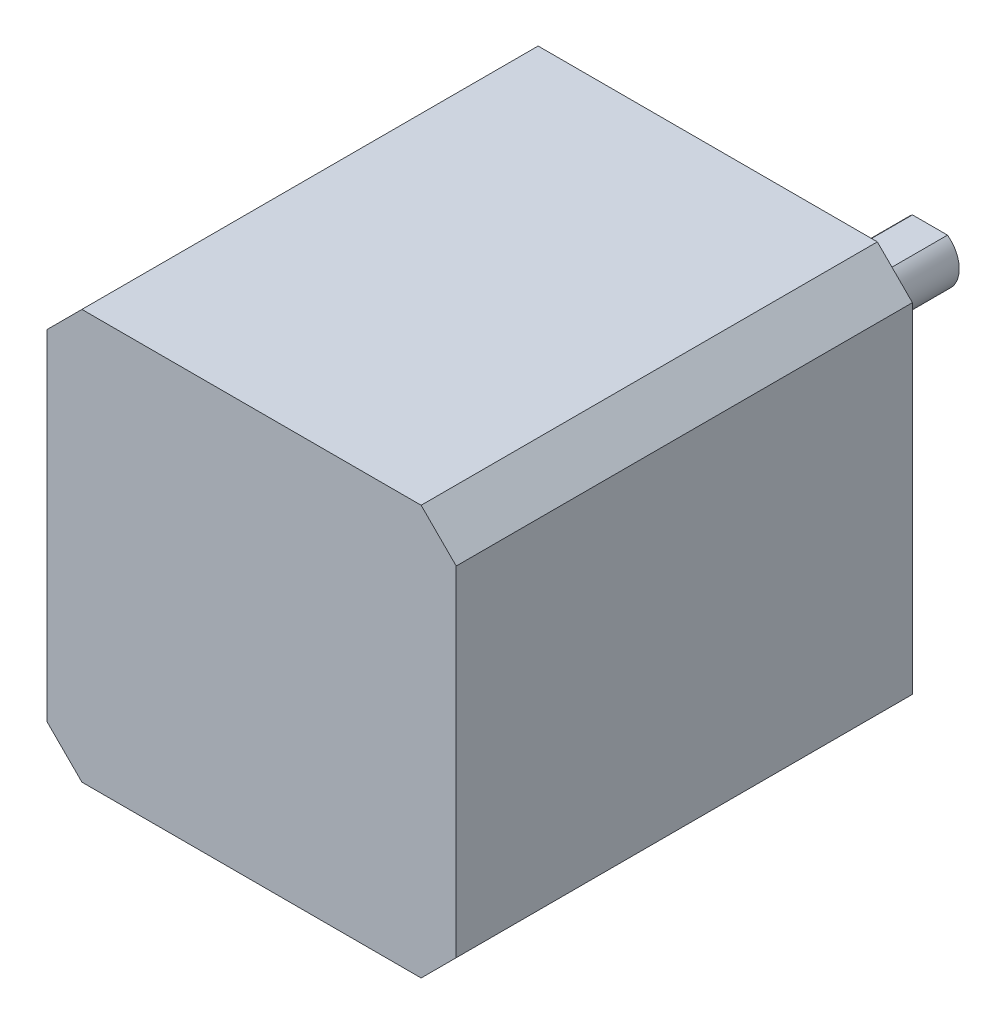
from build123d import *

# Parameters (mm, degrees)
SKETCH_1_W      = 35
SKETCH_1_H      = 35
EXTRUDE_1_DEPTH = 39
SKETCH_2_R      = 11
EXTRUDE_2_DEPTH = 2
EXTRUDE_3_DEPTH = 17
CHAMFER_1_SIZE  = 3


with BuildPart() as part:
    # 草图1 → 凸台-拉伸1 (new body)
    with BuildSketch(Plane.XY):
        Rectangle(SKETCH_1_W, SKETCH_1_H)
    extrude(amount=EXTRUDE_1_DEPTH)

    # 草图2 → 凸台-拉伸2 (add)
    with BuildSketch(Plane(origin=(0, 0, 0), x_dir=(-1, 0, 0), z_dir=(0, 0, -1))):
        Circle(SKETCH_2_R)
    extrude(amount=EXTRUDE_2_DEPTH)

    # 草图3 → 凸台-拉伸3 (add)
    with BuildSketch(Plane(origin=(0, 0, -2), x_dir=(-1, 0, 0), z_dir=(0, 0, -1))):
        with BuildLine():
            Line((-1.5, 2), (1.5, 2))
            ThreePointArc((1.5, 2), (0, -2.5), (-1.5, 2))
        make_face()
    extrude(amount=EXTRUDE_3_DEPTH)

    # 倒角1
    chamfer_1_edges = [part.edges().sort_by_distance(p)[0] for p in [
        (17.5, -17.5, 19.5),
        (-17.5, -17.5, 19.5),
        (-17.5, 17.5, 19.5),
        (17.5, 17.5, 19.5),
    ]]
    chamfer(chamfer_1_edges, length=CHAMFER_1_SIZE)


solid = part.part
